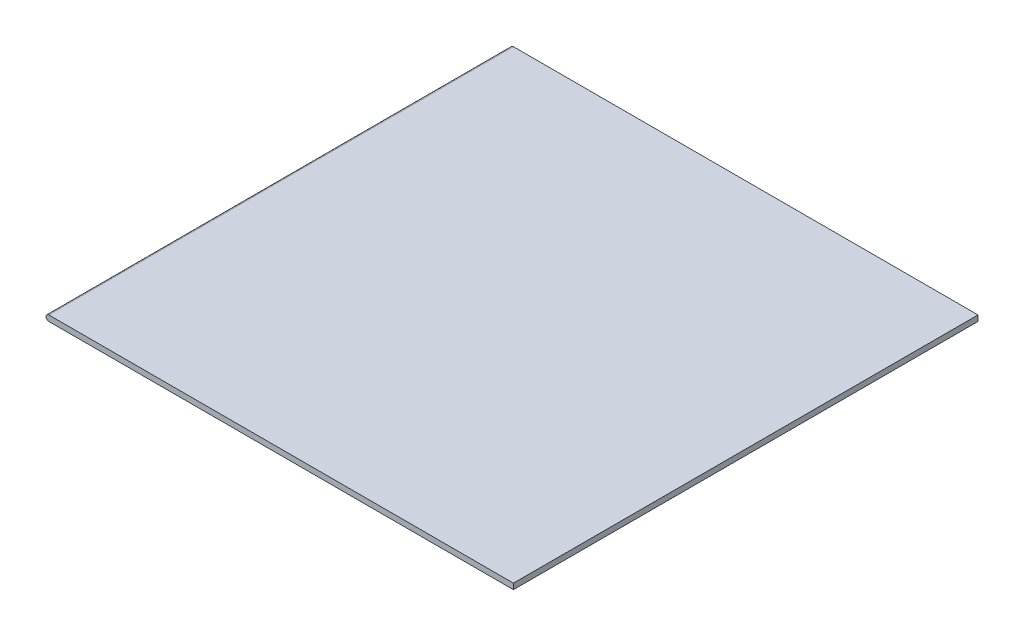
from build123d import *

# Parameters (mm, degrees)
SKETCH_1_W           = 410
SKETCH_1_H           = 410
EXTRUDE_1_DEPTH      = 5
EXTRUDE_2_DEPTH      = 205
EXTRUDE_2_DEPTH_BACK = 205


with BuildPart() as part:
    # Эскиз1 → Бобышка-Вытянуть1 (new body)
    with BuildSketch(Plane(origin=(0, 0, 0), x_dir=(1, 0, 0), z_dir=(0, 1, 0))):
        Rectangle(SKETCH_1_W, SKETCH_1_H)
    extrude(amount=EXTRUDE_1_DEPTH)

    # Эскиз2 → Бобышка-Вытянуть2 (add, two sides: drawn at the far end of the back side and taken through both)
    with BuildSketch(Plane.XY.offset(-EXTRUDE_2_DEPTH_BACK)):
        with BuildLine():
            ThreePointArc((-202.5, 2.5), (-203.232233047, 4.267766953), (-205, 5))
            Line((-205, 5), (-205, 0))
            ThreePointArc((-205, 0), (-203.232233047, 0.732233047), (-202.5, 2.5))
        make_face()
        with BuildLine():
            Line((-205, 0), (-205, 5))
            ThreePointArc((-205, 5), (-207.5, 2.5), (-205, 0))
        make_face()
    extrude(amount=EXTRUDE_2_DEPTH + EXTRUDE_2_DEPTH_BACK)


solid = part.part
